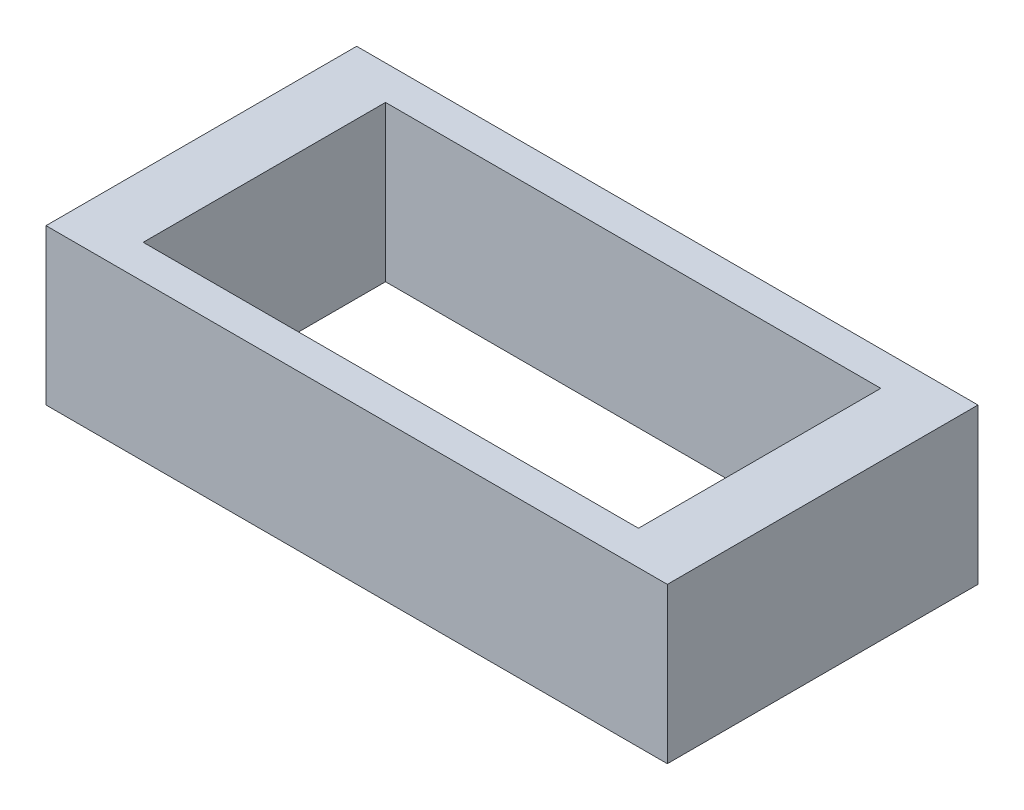
from build123d import *

# Parameters (mm, degrees)
SKETCH1_W           = 50.8
SKETCH1_H           = 25.4
SKETCH1_W_2         = 40.491366428
SKETCH1_H_2         = 19.812
BOSS_EXTRUDE1_DEPTH = 12.7


with BuildPart() as part:
    # Sketch1 → Boss-Extrude1 (new body)
    with BuildSketch(Plane(origin=(0, 0, 0), x_dir=(1, 0, 0), z_dir=(0, 1, 0))):
        with Locations((25.4, 12.7)):
            Rectangle(SKETCH1_W, SKETCH1_H)
        with Locations((25.4, 12.7)):
            Rectangle(SKETCH1_W_2, SKETCH1_H_2, mode=Mode.SUBTRACT)
    extrude(amount=BOSS_EXTRUDE1_DEPTH)


solid = part.part
